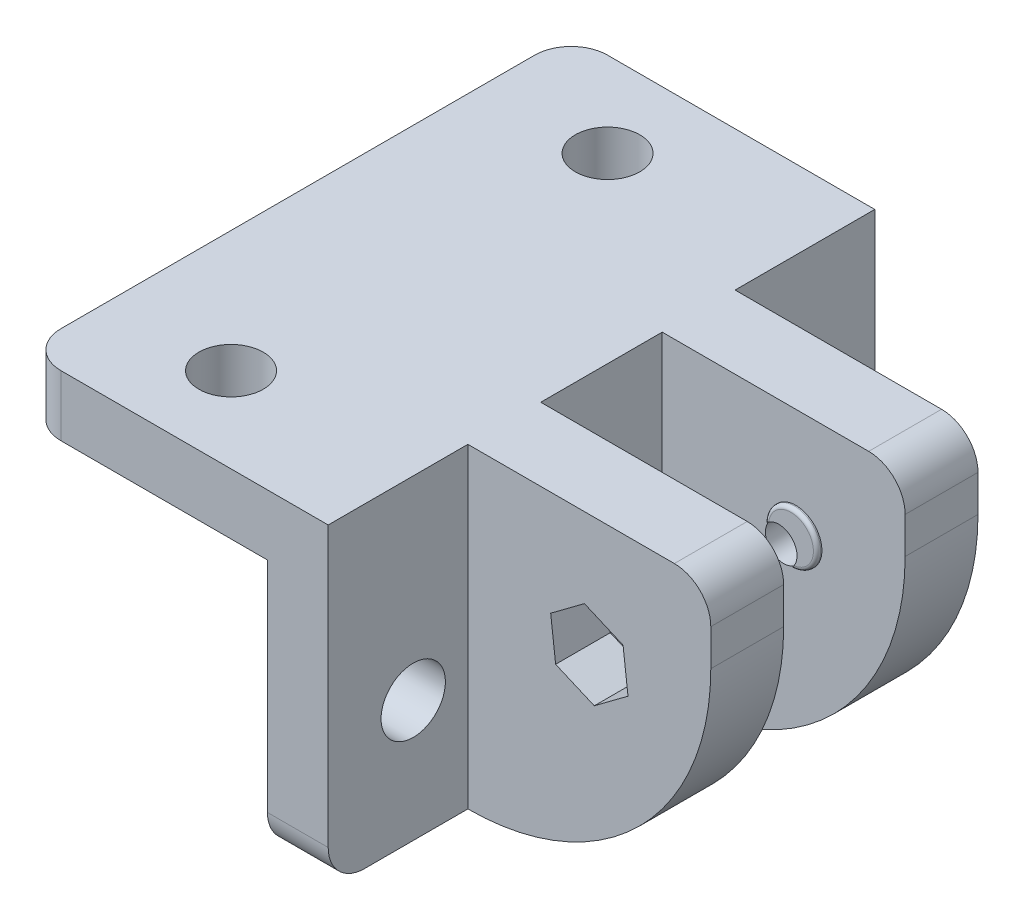
from build123d import *

# Parameters (mm, degrees)
SKETCH1_W           = 45
SKETCH1_H           = 5
BOSS_EXTRUDE1_DEPTH = 20
SKETCH2_W           = 5
SKETCH2_H           = 45
BOSS_EXTRUDE2_DEPTH = 26
SKETCH3_R           = 2.65
CUT_EXTRUDE1_DEPTH  = 26
SKETCH4_R           = 2.65
CUT_EXTRUDE2_DEPTH  = 26
FILLET1_R           = 3
SKETCH5_W           = 6
SKETCH5_H           = 26
BOSS_EXTRUDE3_DEPTH = 20
SKETCH8_R           = 2.15
BOSS_EXTRUDE6_DEPTH = 0.4
BOSS_EXTRUDE5_START = 0.4
SKETCH7_R           = 2.15
BOSS_EXTRUDE5_DEPTH = 0.4
SKETCH6_R           = 1.5
CUT_EXTRUDE3_DEPTH  = 47.778734485
FILLET2_R           = 20
FILLET3_R           = 3
FILLET4_R           = 0.3
FILLET5_R           = 0.3
CUT_EXTRUDE4_DEPTH  = 4.5


with BuildPart() as part:
    # Sketch1 → Boss-Extrude1 (new body)
    with BuildSketch(Plane(origin=(0, 0, 0), x_dir=(0, 0, -1), z_dir=(1, 0, 0))):
        with Locations((22.5, 2.5)):
            Rectangle(SKETCH1_W, SKETCH1_H)
    extrude(amount=-BOSS_EXTRUDE1_DEPTH)

    # Sketch2 → Boss-Extrude2 (add)
    with BuildSketch(Plane(origin=(0, 5, 0), x_dir=(1, 0, 0), z_dir=(0, 1, 0))):
        with Locations((2.5, 22.5)):
            Rectangle(SKETCH2_W, SKETCH2_H)
    extrude(amount=-BOSS_EXTRUDE2_DEPTH)

    # Sketch3 → Cut-Extrude1 (cut)
    with BuildSketch(Plane(origin=(0, 5, 0), x_dir=(1, 0, 0), z_dir=(0, 1, 0))):
        with Locations(Location((-10, 7, 0), (0, 0, 270))):
            Circle(SKETCH3_R)
        with Locations(Location((-10, 38, 0), (0, 0, 270))):
            Circle(SKETCH3_R)
    extrude(amount=-CUT_EXTRUDE1_DEPTH, mode=Mode.SUBTRACT)

    # Sketch4 → Cut-Extrude2 (cut)
    with BuildSketch(Plane(origin=(5, 0, 0), x_dir=(0, 0, -1), z_dir=(1, 0, 0))):
        with Locations((7, -11)):
            Circle(SKETCH4_R)
        with Locations((38, -11)):
            Circle(SKETCH4_R)
    extrude(amount=-CUT_EXTRUDE2_DEPTH, mode=Mode.SUBTRACT)

    # Fillet1
    fillet1_edges = [part.edges().sort_by_distance(p)[0] for p in [
        (-20, 2.5, -45),
        (2.5, -21, -45),
        (2.5, -21, 0),
        (-20, 2.5, 0),
    ]]
    fillet(fillet1_edges, radius=FILLET1_R)

    # Sketch5 → Boss-Extrude3 (add)
    with BuildSketch(Plane(origin=(5, 0, 0), x_dir=(0, 0, -1), z_dir=(1, 0, 0))):
        with Locations((30.5, -8)):
            Rectangle(SKETCH5_W, SKETCH5_H)
        with Locations((14.5, -8)):
            Rectangle(SKETCH5_W, SKETCH5_H)
    extrude(amount=BOSS_EXTRUDE3_DEPTH)

    # Sketch8 → Boss-Extrude6 (add)
    with BuildSketch(Plane.XY.offset(-27.5)):
        with Locations(Location((16, -4, 0), (0, 0, 180))):
            Circle(SKETCH8_R)
    extrude(amount=BOSS_EXTRUDE6_DEPTH)

    # Sketch7 → Boss-Extrude5 (add)
    with BuildSketch(Plane(origin=(0, 0, -17.5), x_dir=(-1, 0, 0), z_dir=(0, 0, -1)).offset(BOSS_EXTRUDE5_START)):
        with Locations((-16, -4)):
            Circle(SKETCH7_R)
    extrude(amount=-BOSS_EXTRUDE5_DEPTH)

    # Sketch6 → Cut-Extrude3 (cut, through all)
    with BuildSketch(Plane.XY.offset(-11.5)):
        with Locations((15, -5)):
            Circle(SKETCH6_R)
    extrude(amount=-CUT_EXTRUDE3_DEPTH, mode=Mode.SUBTRACT)

    # Fillet2
    fillet2_edges = [part.edges().sort_by_distance(p)[0] for p in [
        (25, -21, -14.5),
        (25, -21, -30.5),
    ]]
    fillet(fillet2_edges, radius=FILLET2_R)

    # Fillet3
    fillet3_edges = [part.edges().sort_by_distance(p)[0] for p in [
        (25, 5, -30.5),
        (25, 5, -14.5),
    ]]
    fillet(fillet3_edges, radius=FILLET3_R)

    # Fillet4
    fillet4_edges = [part.edges().sort_by_distance(p)[0] for p in [
        (17.52027958, -2.47972042, -27.1),
    ]]
    fillet(fillet4_edges, radius=FILLET4_R)

    # Fillet5
    fillet5_edges = [part.edges().sort_by_distance(p)[0] for p in [
        (17.52027958, -2.47972042, -17.9),
    ]]
    fillet(fillet5_edges, radius=FILLET5_R)

    # Sketch9 → Cut-Extrude4 (cut)
    with BuildSketch(Plane.XY.offset(-11.5)):
        Polygon((14.592572309, -1.559941472), (11.817108079, -3.632813466), (12.224535769, -7.072871994), (15.407427691, -8.440058528), (18.182891921, -6.367186534), (17.775464231, -2.927128006), align=None)
    extrude(amount=-CUT_EXTRUDE4_DEPTH, mode=Mode.SUBTRACT)


solid = part.part
